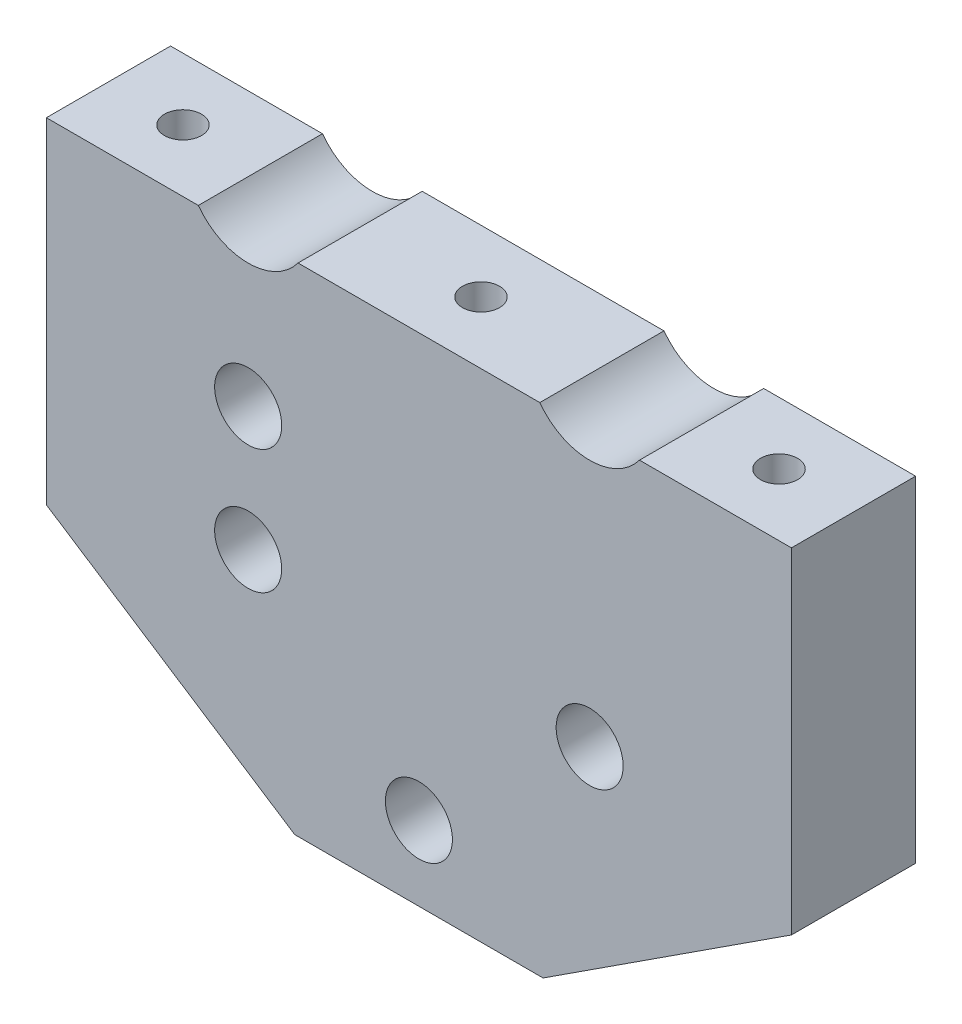
from build123d import *

# Parameters (mm, degrees)
SKETCH1_R                  = 3.429
BOSS_EXTRUDE1_DEPTH        = 12.7
F_10_24_TAPPED_HOLE1_D     = 3.7973
F_10_24_TAPPED_HOLE1_DEPTH = 19.05
F_10_24_TAPPED_HOLE1_TIP   = 1.140824014


with BuildPart() as part:
    # Sketch1 → Boss-Extrude1 (new body)
    with BuildSketch(Plane.XY):
        with BuildLine():
            Line((-38.1, -17.145), (-38.1, 17.145))
            Line((-38.1, 17.145), (-22.561451151, 17.145))
            ThreePointArc((-22.561451151, 17.145), (-17.4625, 14.5796), (-12.363548849, 17.145))
            Line((-12.363548849, 17.145), (12.363548849, 17.145))
            ThreePointArc((12.363548849, 17.145), (17.4625, 14.5796), (22.561451151, 17.145))
            Line((22.561451151, 17.145), (38.1, 17.145))
            Line((38.1, 17.145), (38.1, -17.145))
            Line((38.1, -17.145), (12.7, -33.655))
            Line((12.7, -33.655), (-12.7, -33.655))
            Line((-12.7, -33.655), (-38.1, -17.145))
        make_face()
        with Locations((-17.4625, -10.795)):
            Circle(SKETCH1_R, mode=Mode.SUBTRACT)
        with Locations(Location((17.4625, -10.795, 0), (0, 0, 180))):
            Circle(SKETCH1_R, mode=Mode.SUBTRACT)
        with Locations((-17.4625, 1.905)):
            Circle(SKETCH1_R, mode=Mode.SUBTRACT)
        with Locations((0, -26.035)):
            Circle(SKETCH1_R, mode=Mode.SUBTRACT)
    extrude(amount=BOSS_EXTRUDE1_DEPTH)

    # #10-24 Tapped Hole1
    with Locations(Plane(origin=(0, 17.145, 0), x_dir=(1, 0, 0), z_dir=(0, 1, 0))):
        with Locations((-30.48, -6.35), (0, -6.35), (30.48, -6.35)):
            Hole(F_10_24_TAPPED_HOLE1_D / 2, depth=F_10_24_TAPPED_HOLE1_DEPTH)
            with Locations((0, 0, -(F_10_24_TAPPED_HOLE1_DEPTH + F_10_24_TAPPED_HOLE1_TIP / 2))):  # 118° drill point
                Cone(0, F_10_24_TAPPED_HOLE1_D / 2, F_10_24_TAPPED_HOLE1_TIP, mode=Mode.SUBTRACT)


solid = part.part
